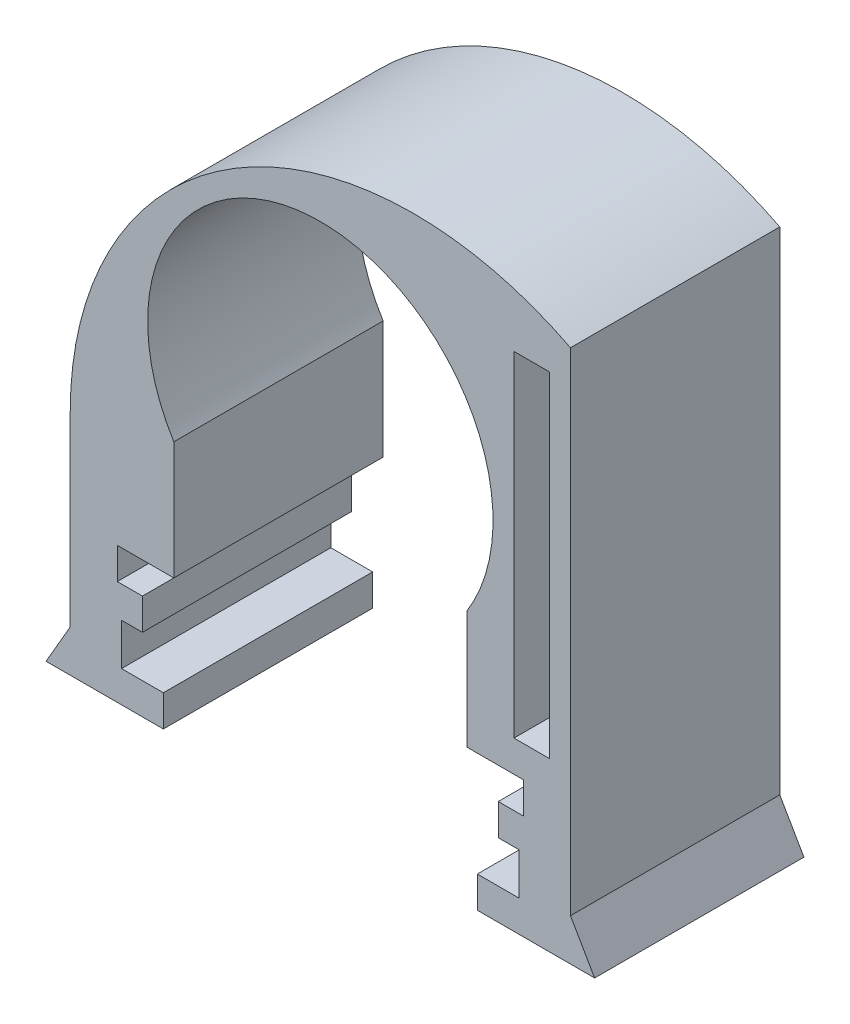
from build123d import *

# Parameters (mm, degrees)
SKETCH1_W           = 1.7
SKETCH1_H           = 16
BOSS_EXTRUDE1_DEPTH = 10


with BuildPart() as part:
    # Sketch1 → Boss-Extrude1 (new body)
    with BuildSketch(Plane.XY):
        with BuildLine():
            Line((8.5, -13), (9.5, -13))
            Line((9.5, -13), (9.5, -15))
            Line((9.5, -15), (7.5, -15))
            Line((7.5, -15), (7.5, -16.5))
            Line((7.5, -16.5), (13.104700538, -16.5))
            Line((13.104700538, -16.5), (11.95, -14.5))
            Line((11.95, -14.5), (11.95, 9))
            ThreePointArc((11.95, 9), (-4.095088976, 8.402289312), (-11.95, -5.60137132))
            Line((-11.95, -5.60137132), (-11.95, -14.5))
            Line((-11.95, -14.5), (-13.104700538, -16.5))
            Line((-13.104700538, -16.5), (-7.5, -16.5))
            Line((-7.5, -16.5), (-7.5, -15))
            Line((-7.5, -15), (-9.5, -15))
            Line((-9.5, -15), (-9.5, -13))
            Line((-9.5, -13), (-8.5, -13))
            Line((-8.5, -13), (-8.5, -11.5))
            Line((-8.5, -11.5), (-9.7, -11.5))
            Line((-9.7, -11.5), (-9.7, -10))
            Line((-9.7, -10), (-7, -10))
            Line((-7, -10), (-7, -4.366062299))
            ThreePointArc((-7, -4.366062299), (0, 8.25), (7, -4.366062299))
            Line((7, -4.366062299), (7, -10))
            Line((7, -10), (9.7, -10))
            Line((9.7, -10), (9.7, -11.5))
            Line((9.7, -11.5), (8.5, -11.5))
            Line((8.5, -11.5), (8.5, -13))
        make_face()
        with Locations((10.1, -0.5)):
            Rectangle(SKETCH1_W, SKETCH1_H, mode=Mode.SUBTRACT)
    extrude(amount=BOSS_EXTRUDE1_DEPTH)


solid = part.part
